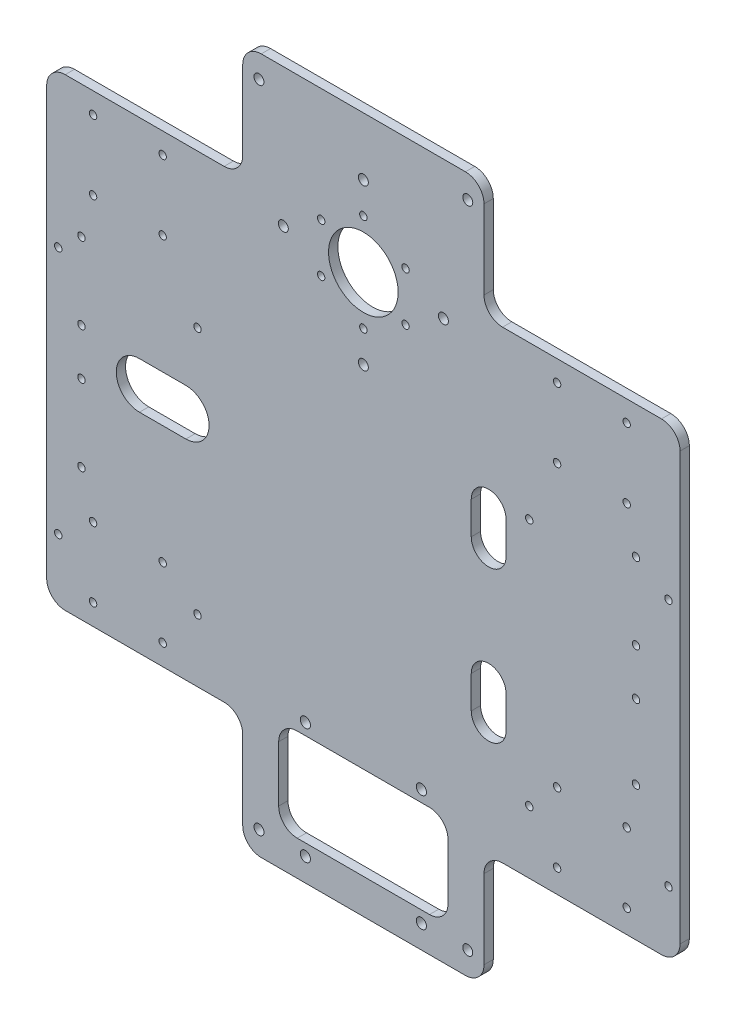
from build123d import *

# Parameters (mm, degrees)
SKETCH_281X300_25_R   = 1.6
SKETCH_281X300_25_R_2 = 15
SKETCH_281X300_25_R_3 = 2.15
SKETCH_281X300_25_R_4 = 2.2
SKETCH_281X300_25_W   = 73
SKETCH_281X300_25_H   = 40
F_4MM_DEPTH           = 4
FILLET_1_R            = 8


with BuildPart() as part:
    # 底板轮廓_281x300_安装孔外移25 → 凸台拉伸_4mm (new body)
    with BuildSketch(Plane.XY):
        Polygon((-51, 150), (53, 150), (53, 100), (137.5, 100), (137.5, -100), (53, -100), (53, -150), (-51, -150), (-51, -100), (-135.5, -100), (-135.5, 100), (-51, 100), align=None)
        with Locations((84.5, -60)):
            Circle(SKETCH_281X300_25_R, mode=Mode.SUBTRACT)
        with Locations((114.5, -60)):
            Circle(SKETCH_281X300_25_R, mode=Mode.SUBTRACT)
        with Locations((84.5, 61)):
            Circle(SKETCH_281X300_25_R, mode=Mode.SUBTRACT)
        with Locations((1, 90.5)):
            Circle(SKETCH_281X300_25_R_2, mode=Mode.SUBTRACT)
        with Locations((1, 125)):
            Circle(SKETCH_281X300_25_R_3, mode=Mode.SUBTRACT)
        with Locations((-33.5, 90.5)):
            Circle(SKETCH_281X300_25_R_3, mode=Mode.SUBTRACT)
        with Locations((35.5, 90.5)):
            Circle(SKETCH_281X300_25_R_3, mode=Mode.SUBTRACT)
        with Locations((-44, 140)):
            Circle(SKETCH_281X300_25_R_3, mode=Mode.SUBTRACT)
        with Locations((114.5, 61)):
            Circle(SKETCH_281X300_25_R, mode=Mode.SUBTRACT)
        with Locations((1, 56)):
            Circle(SKETCH_281X300_25_R_3, mode=Mode.SUBTRACT)
        with Locations((26, -140)):
            Circle(SKETCH_281X300_25_R_4, mode=Mode.SUBTRACT)
        with Locations((-24, -140)):
            Circle(SKETCH_281X300_25_R_4, mode=Mode.SUBTRACT)
        with Locations((-24, -90)):
            Circle(SKETCH_281X300_25_R_4, mode=Mode.SUBTRACT)
        with Locations((26, -90)):
            Circle(SKETCH_281X300_25_R_4, mode=Mode.SUBTRACT)
        with Locations((1, 111.5)):
            Circle(SKETCH_281X300_25_R, mode=Mode.SUBTRACT)
        with Locations((84.5, -90)):
            Circle(SKETCH_281X300_25_R, mode=Mode.SUBTRACT)
        with Locations((84.5, 91)):
            Circle(SKETCH_281X300_25_R, mode=Mode.SUBTRACT)
        with Locations((114.5, 91)):
            Circle(SKETCH_281X300_25_R, mode=Mode.SUBTRACT)
        with Locations((114.5, -90)):
            Circle(SKETCH_281X300_25_R, mode=Mode.SUBTRACT)
        with Locations((118.5, 10)):
            Circle(SKETCH_281X300_25_R, mode=Mode.SUBTRACT)
        with Locations((118.5, -10)):
            Circle(SKETCH_281X300_25_R, mode=Mode.SUBTRACT)
        with Locations((-120.5, 10)):
            Circle(SKETCH_281X300_25_R, mode=Mode.SUBTRACT)
        with Locations((-120.5, -10)):
            Circle(SKETCH_281X300_25_R, mode=Mode.SUBTRACT)
        with Locations((-115.5, -91)):
            Circle(SKETCH_281X300_25_R, mode=Mode.SUBTRACT)
        with Locations((-85.5, -91)):
            Circle(SKETCH_281X300_25_R, mode=Mode.SUBTRACT)
        with Locations((-115.5, 91)):
            Circle(SKETCH_281X300_25_R, mode=Mode.SUBTRACT)
        with Locations((-85.5, 91)):
            Circle(SKETCH_281X300_25_R, mode=Mode.SUBTRACT)
        with Locations((-85.5, 61)):
            Circle(SKETCH_281X300_25_R, mode=Mode.SUBTRACT)
        with Locations((-115.5, 61)):
            Circle(SKETCH_281X300_25_R, mode=Mode.SUBTRACT)
        with Locations((-85.5, -61)):
            Circle(SKETCH_281X300_25_R, mode=Mode.SUBTRACT)
        with Locations((-115.5, -61)):
            Circle(SKETCH_281X300_25_R, mode=Mode.SUBTRACT)
        with Locations((118.5, 43)):
            Circle(SKETCH_281X300_25_R, mode=Mode.SUBTRACT)
        with Locations((118.5, -42)):
            Circle(SKETCH_281X300_25_R, mode=Mode.SUBTRACT)
        with Locations((-120.5, 43)):
            Circle(SKETCH_281X300_25_R, mode=Mode.SUBTRACT)
        with Locations((46, 140)):
            Circle(SKETCH_281X300_25_R_3, mode=Mode.SUBTRACT)
        with Locations((-44, -140)):
            Circle(SKETCH_281X300_25_R_3, mode=Mode.SUBTRACT)
        with Locations((46, -140)):
            Circle(SKETCH_281X300_25_R_3, mode=Mode.SUBTRACT)
        with Locations((19.186533479, 101)):
            Circle(SKETCH_281X300_25_R, mode=Mode.SUBTRACT)
        with Locations((19.186533479, 80)):
            Circle(SKETCH_281X300_25_R, mode=Mode.SUBTRACT)
        with Locations((1, 69.5)):
            Circle(SKETCH_281X300_25_R, mode=Mode.SUBTRACT)
        with Locations((-17.186533479, 80)):
            Circle(SKETCH_281X300_25_R, mode=Mode.SUBTRACT)
        with Locations((-17.186533479, 101)):
            Circle(SKETCH_281X300_25_R, mode=Mode.SUBTRACT)
        with Locations((-120.5, -43)):
            Circle(SKETCH_281X300_25_R, mode=Mode.SUBTRACT)
        with Locations((132.5, 34)):
            Circle(SKETCH_281X300_25_R, mode=Mode.SUBTRACT)
        with Locations((132.5, -73)):
            Circle(SKETCH_281X300_25_R, mode=Mode.SUBTRACT)
        with Locations((72.5, 34)):
            Circle(SKETCH_281X300_25_R, mode=Mode.SUBTRACT)
        with Locations((72.5, -73)):
            Circle(SKETCH_281X300_25_R, mode=Mode.SUBTRACT)
        with Locations((-130.5, 34)):
            Circle(SKETCH_281X300_25_R, mode=Mode.SUBTRACT)
        with Locations((-70.5, 34)):
            Circle(SKETCH_281X300_25_R, mode=Mode.SUBTRACT)
        with Locations((-130.5, -73)):
            Circle(SKETCH_281X300_25_R, mode=Mode.SUBTRACT)
        with Locations((-70.5, -73)):
            Circle(SKETCH_281X300_25_R, mode=Mode.SUBTRACT)
        with BuildLine():
            Line((62.5, -50), (62.5, -36))
            ThreePointArc((62.5, -36), (55, -28.5), (47.5, -36))
            Line((47.5, -36), (47.5, -50))
            ThreePointArc((47.5, -50), (55, -57.5), (62.5, -50))
        make_face(mode=Mode.SUBTRACT)
        with BuildLine():
            Line((-95.5, -10), (-75.5, -10))
            ThreePointArc((-75.5, -10), (-65.5, 0), (-75.5, 10))
            Line((-75.5, 10), (-95.5, 10))
            ThreePointArc((-95.5, 10), (-105.5, 0), (-95.5, -10))
        make_face(mode=Mode.SUBTRACT)
        with Locations((1, -115)):
            Rectangle(SKETCH_281X300_25_W, SKETCH_281X300_25_H, mode=Mode.SUBTRACT)
        with BuildLine():
            Line((47.5, 29), (47.5, 15))
            ThreePointArc((47.5, 15), (55, 7.5), (62.5, 15))
            Line((62.5, 15), (62.5, 29))
            ThreePointArc((62.5, 29), (55, 36.5), (47.5, 29))
        make_face(mode=Mode.SUBTRACT)
    extrude(amount=F_4MM_DEPTH)

    # 圆角1
    fillet_1_edges = [part.edges().sort_by_distance(p)[0] for p in [
        (53, -150, 2),
        (-51, -150, 2),
        (-51, -100, 2),
        (-135.5, -100, 2),
        (-135.5, 100, 2),
        (-51, 100, 2),
        (-51, 150, 2),
        (53, 150, 2),
        (53, 100, 2),
        (137.5, 100, 2),
        (137.5, -100, 2),
        (53, -100, 2),
        (-35.5, -95, 2),
        (-35.5, -135, 2),
        (37.5, -135, 2),
        (37.5, -95, 2),
    ]]
    fillet(fillet_1_edges, radius=FILLET_1_R)


solid = part.part
